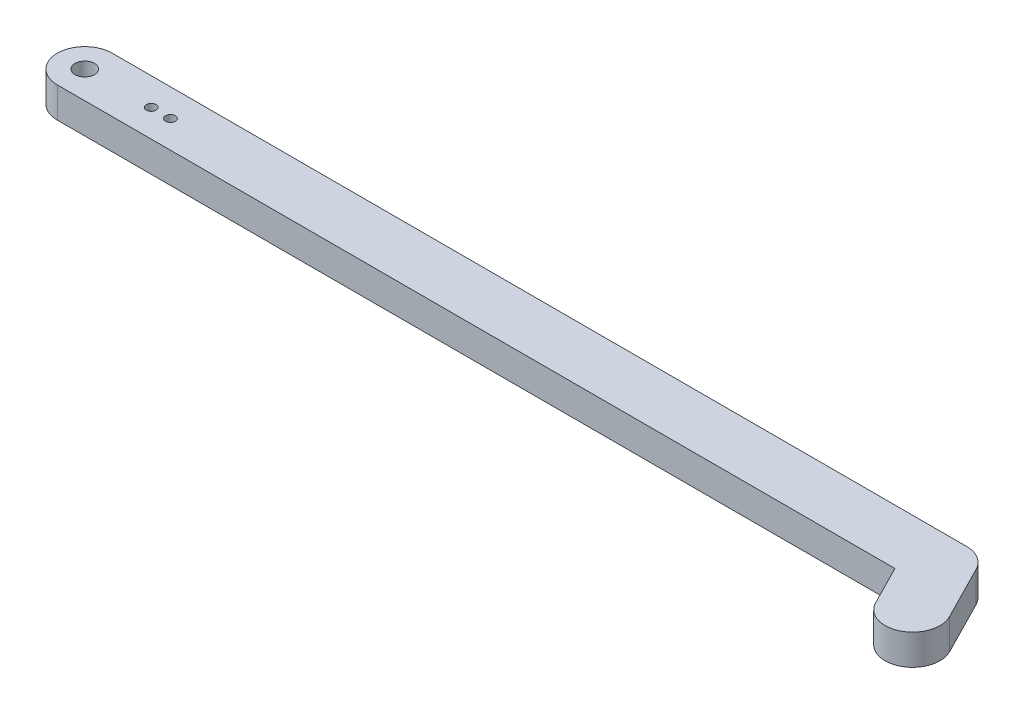
from build123d import *

# Parameters (mm, degrees)
SKETCH1_R           = 1.6
SKETCH1_R_2         = 0.8
BOSS_EXTRUDE1_DEPTH = 5


with BuildPart() as part:
    # Sketch1 → Boss-Extrude1 (new body)
    # profile 1 of 2: a face of its own
    with BuildSketch(Plane(origin=(0, 0, 0), x_dir=(1, 0, 0), z_dir=(0, 1, 0))):
        with BuildLine():
            Line((0, 4.5), (140, 4.5))
            ThreePointArc((140, 4.5), (144.5, 0), (140, -4.5))
            Line((140, -4.5), (0, -4.5))
            ThreePointArc((0, -4.5), (-4.5, 0), (0, 4.5))
        make_face()
        with Locations(Location((0, 0, 0), (0, 0, 270))):
            Circle(SKETCH1_R, mode=Mode.SUBTRACT)
        with Locations(Location((10.88, 0, 0), (0, 0, 270))):
            Circle(SKETCH1_R_2, mode=Mode.SUBTRACT)
        with Locations(Location((14.03, 0, 0), (0, 0, 270))):
            Circle(SKETCH1_R_2, mode=Mode.SUBTRACT)
    # profile 2 of 2: a face of its own
    with BuildSketch(Plane(origin=(0, 0, 0), x_dir=(1, 0, 0), z_dir=(0, 1, 0))):
        with BuildLine():
            Line((144.009501751, 2.043011432), (148.549527155, -6.866992459))
            ThreePointArc((148.549527155, -6.866992459), (146.583036835, -12.919505642), (140.530523653, -10.953015322))
            Line((140.530523653, -10.953015322), (135.990498249, -2.043011432))
            ThreePointArc((135.990498249, -2.043011432), (137.956988568, 4.009501751), (144.009501751, 2.043011432))
        make_face()
    extrude(amount=BOSS_EXTRUDE1_DEPTH)


solid = part.part
